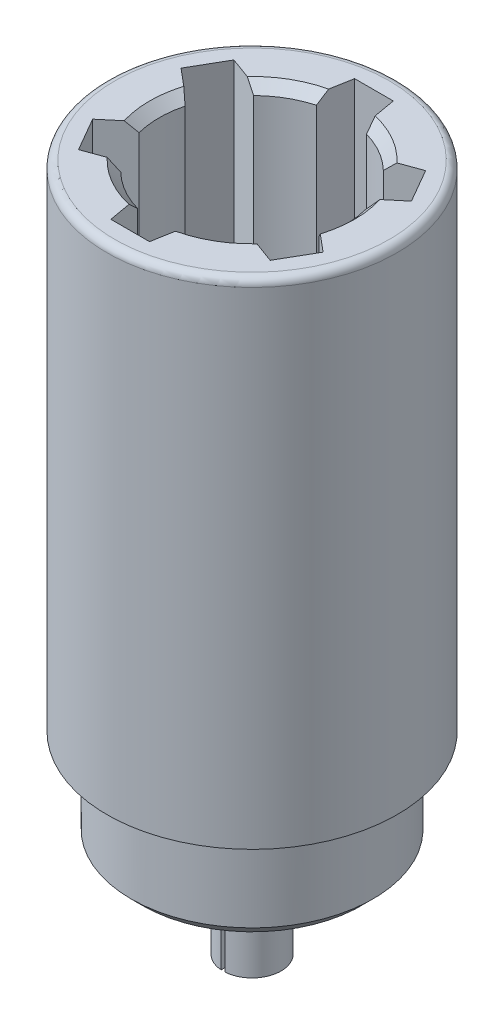
from build123d import *

# Parameters (mm, degrees)
CHAMFER1_SIZE           = 0.635
FILLET3_R               = 0.508
CUT_EXTRUDE8_REACH      = 49.123
CIRPATTERN1_COUNT       = 6
FILLET4_R               = 0.762
CUT_EXTRUDE9_DEPTH      = 41.411152568
CUT_EXTRUDE9_DEPTH_BACK = 41.411152568
SKETCH15_W              = 0.254
SKETCH15_H              = 25.164906623
CHAMFER2_SIZE           = 0.762


with BuildPart() as part:
    # Sketch1 → mainBody (revolve)
    with BuildSketch(Plane(origin=(0, 0, 0), x_dir=(0, 0, -1), z_dir=(1, 0, 0)), mode=Mode.PRIVATE) as mainbody_sk:
        Polygon((-6.096, 38.1), (-6.096, 8.705990249), (0, 0), (0, -7.057106074), (-1.905, -7.057106074), (-1.905, -0.707106074), (-7.9375, -0.707106074), (-7.9375, 5.642893926), (-9.525, 5.642893926), (-9.525, 38.1), align=None)
    revolve(mainbody_sk.sketch.rotate(Axis((0, 0, 0), (0, 1, 0)), 180), axis=Axis((0, 0, 0), (0, 1, 0)))

    # Chamfer1
    chamfer1_edges = [part.edges().sort_by_distance(p)[0] for p in [
        (0, 38.1, 6.096),
    ]]
    chamfer(chamfer1_edges, length=CHAMFER1_SIZE)

    # Fillet3
    fillet3_edges = [part.edges().sort_by_distance(p)[0] for p in [
        (0, 38.1, 9.525),
    ]]
    fillet(fillet3_edges, radius=FILLET3_R)

    # Cut-Extrude8: up to this cone (the profile starts inside it)
    cut_extrude8_end = Plane(origin=(0, 38.1, 0), z_dir=(0, 1, 0)).offset(-38.099999) * Cone(1e-06, 80.104377604, 114.400906206, align=(Align.CENTER, Align.CENTER, Align.MIN), mode=Mode.PRIVATE)
    # Sketch13 → Cut-Extrude8 (cut, up to the surface)
    with BuildSketch(Plane(origin=(0, 38.1, 0), x_dir=(1, 0, 0), z_dir=(0, 1, 0)), mode=Mode.PRIVATE) as cut_extrude8_sk1:
        Polygon((-1.27, 8.001), (1.27, 8.001), (2.27589157, 2.296305428), (-2.27589157, 2.296305428), align=None)
    cut_extrude8_tool1 = extrude(cut_extrude8_sk1.sketch, amount=-CUT_EXTRUDE8_REACH, mode=Mode.PRIVATE) & cut_extrude8_end
    cut_extrude8 = cut_extrude8_tool1.solids().sort_by_distance((0, 38.1, -4.878937))[0]
    add(cut_extrude8, mode=Mode.SUBTRACT)

    # CirPattern1: Cut-Extrude8 ×6 about axis
    cirpattern1_axis = Axis((0, 0, 0), (0, 1, 0))
    for i in range(1, CIRPATTERN1_COUNT):
        add(cut_extrude8.rotate(cirpattern1_axis, i * 360 / CIRPATTERN1_COUNT), mode=Mode.SUBTRACT)

    # Fillet4
    fillet4_edges = [part.edges().sort_by_distance(p)[0] for p in [
        (0, -0.707106074, 1.905),
    ]]
    fillet(fillet4_edges, radius=FILLET4_R)

    # Sketch15 → Cut-Extrude9 (cut, two sides: drawn at the far end of the back side and taken through both)
    with BuildSketch(Plane.XY.offset(-CUT_EXTRUDE9_DEPTH_BACK)):
        with Locations((0, -13.289559386)):
            Rectangle(SKETCH15_W, SKETCH15_H)
    extrude(amount=CUT_EXTRUDE9_DEPTH + CUT_EXTRUDE9_DEPTH_BACK, mode=Mode.SUBTRACT)

    # Chamfer2
    chamfer2_edges = [part.edges().sort_by_distance(p)[0] for p in [
        (0, -0.707106074, 7.9375),
    ]]
    chamfer(chamfer2_edges, length=CHAMFER2_SIZE)


solid = part.part
